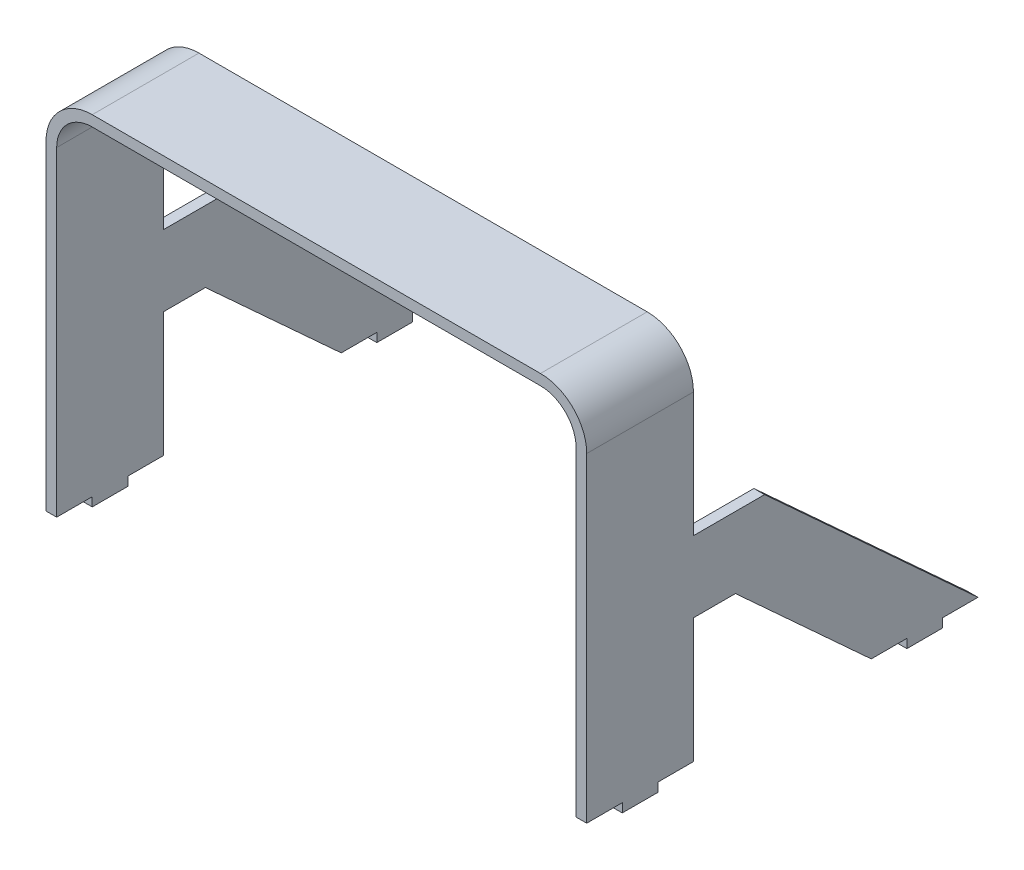
from build123d import *

# Parameters (mm, degrees)
BOSS_EXTRUDE1_DEPTH = 30
BOSS_EXTRUDE2_START = 73
BOSS_EXTRUDE2_DEPTH = 3
SKETCH3_W           = 3
SKETCH3_H           = 10
BOSS_EXTRUDE3_DEPTH = 2.5


with BuildPart() as part:
    # Sketch1 → Boss-Extrude1 (new body)
    with BuildSketch(Plane.XY):
        with BuildLine():
            Line((-73, 0), (-73, 90))
            ThreePointArc((-73, 90), (-70.071067812, 97.071067812), (-63, 100))
            Line((-63, 100), (63, 100))
            ThreePointArc((63, 100), (70.071067812, 97.071067812), (73, 90))
            Line((73, 90), (73, 0))
            Line((73, 0), (76, 0))
            Line((76, 0), (76, 90))
            ThreePointArc((76, 90), (72.192388155, 99.192388155), (63, 103))
            Line((63, 103), (-63, 103))
            ThreePointArc((-63, 103), (-72.192388155, 99.192388155), (-76, 90))
            Line((-76, 90), (-76, 0))
            Line((-76, 0), (-73, 0))
        make_face()
    extrude(amount=BOSS_EXTRUDE1_DEPTH)

    # Sketch2 → Boss-Extrude2 (add)
    with BuildSketch(Plane(origin=(0, 0, 0), x_dir=(0, 0, -1), z_dir=(1, 0, 0)).offset(BOSS_EXTRUDE2_START)):
        Polygon((0, 55), (20, 55), (80, 0), (50, 0), (11.818181818, 35), (0, 35), align=None)
    boss_extrude2 = extrude(amount=BOSS_EXTRUDE2_DEPTH)

    # Mirror1: Boss-Extrude2 across plane
    add(boss_extrude2.mirror(Plane(origin=(0, 0, 0), x_dir=(0, 0, 1), z_dir=(1, 0, 0))))

    # Sketch3 → Boss-Extrude3 (add)
    with BuildSketch(Plane.XZ):
        with Locations((-74.5, 15)):
            Rectangle(SKETCH3_W, SKETCH3_H)
        with Locations((-74.5, -65)):
            Rectangle(SKETCH3_W, SKETCH3_H)
        with Locations((74.5, -65)):
            Rectangle(SKETCH3_W, SKETCH3_H)
        with Locations((74.5, 15)):
            Rectangle(SKETCH3_W, SKETCH3_H)
    extrude(amount=BOSS_EXTRUDE3_DEPTH)


solid = part.part
